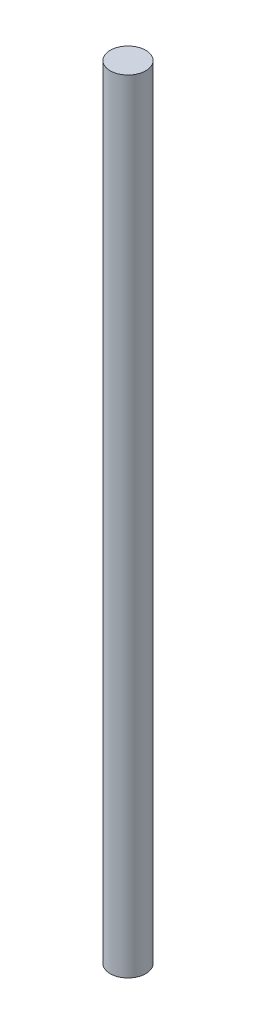
from build123d import *

# Parameters (mm, degrees)
SKIZZE1_R                       = 2.5
AUFSATZ_LINEAR_AUSTRAGEN1_DEPTH = 110


with BuildPart() as part:
    # Skizze1 → Aufsatz-Linear austragen1 (new body)
    with BuildSketch(Plane(origin=(0, 0, 0), x_dir=(1, 0, 0), z_dir=(0, 1, 0))):
        with Locations(Location((0, 0, 0), (0, 0, 270))):
            Circle(SKIZZE1_R)
    extrude(amount=-AUFSATZ_LINEAR_AUSTRAGEN1_DEPTH)


solid = part.part
